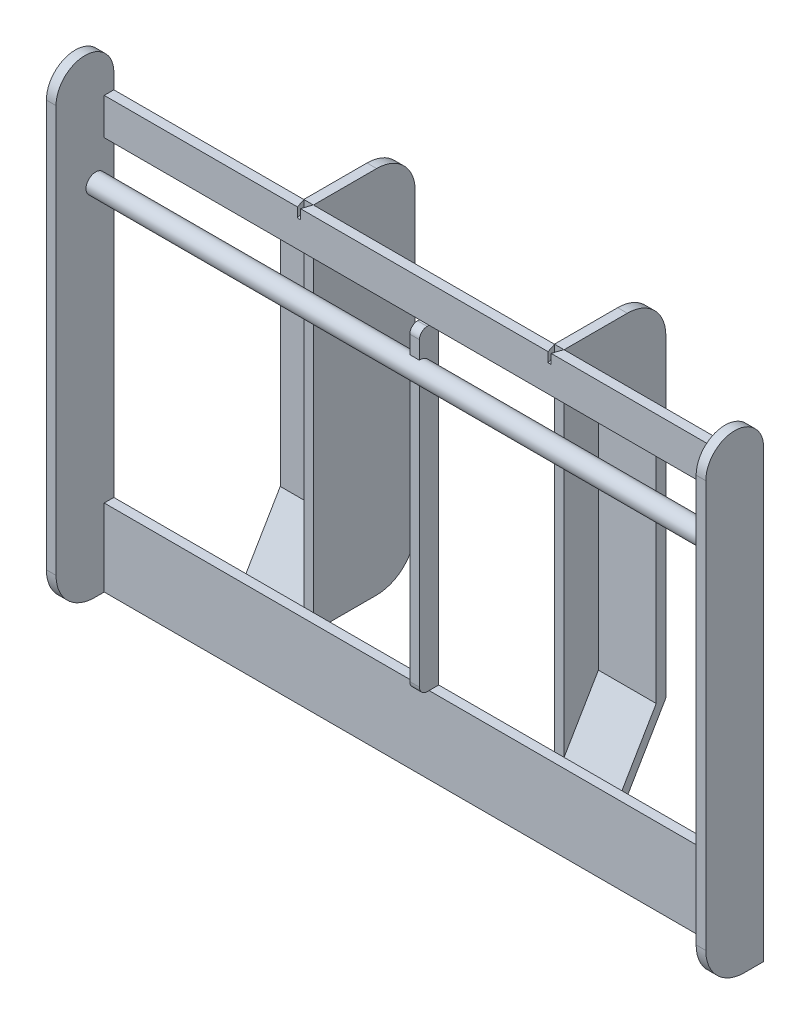
from build123d import *

# Parameters (mm, degrees)
SKETCH1_W                       = 25
SKETCH1_H                       = 264
BOSS_EXTRUDE1_DEPTH             = 958
BOSS_EXTRUDE2_DEPTH             = 150
SKETCH3_W                       = 1660
SKETCH3_H                       = 95
SKETCH3_H_2                     = 200
BOSS_EXTRUDE3_DEPTH             = 25
SKETCH4_W                       = 150
SKETCH4_H                       = 1230
BOSS_EXTRUDE4_DEPTH             = 25
BOSS_EXTRUDE5_REACH             = 1435.453
SKETCH5_R                       = 25
BOSS_EXTRUDE5_DIRECTION_2_REACH = 1435.453
BOSS_EXTRUDE6_REACH             = 1362.836
SKETCH6_W                       = 25
SKETCH6_H                       = 50
FILLET1_RADIUS                  = 75
FILLET1_LENGTH                  = 25
FILLET2_RADIUS                  = 75
FILLET2_LENGTH                  = 25
FILLET3_R                       = 100
FILLET4_R                       = 100
FILLET5_R                       = 100
FILLET6_R                       = 100
FILLET7_R                       = 20
FILLET8_R                       = 20
FILLET9_R                       = 100
FILLET10_R                      = 100
CUT_EXTRUDE5_DEPTH              = 25


with BuildPart() as part:
    # Sketch1 → Boss-Extrude1 (new body)
    with BuildSketch(Plane(origin=(0, 0, 0), x_dir=(1, 0, 0), z_dir=(0, 1, 0))):
        with Locations((325, 0)):
            Rectangle(SKETCH1_W, SKETCH1_H)
    extrude(amount=-BOSS_EXTRUDE1_DEPTH)

    # Sketch2 → Boss-Extrude2 (add)
    with BuildSketch(Plane(origin=(337.5, 0, 0), x_dir=(0, 0, -1), z_dir=(1, 0, 0))):
        Polygon((-43, -139.55), (-43, -763.99), (-132, -915.453947368), (-132, -958), (-18, -763.99), (-18, -139.55), (-132, 0), (-132, -30.603070175), align=None)
    extrude(amount=BOSS_EXTRUDE2_DEPTH)


with BuildPart() as body_2:
    # Mirror2: mirrored copy
    add(part.part.mirror(Plane(origin=(0, 0, 0), x_dir=(0, 0, 1), z_dir=(1, 0, 0))))


with BuildPart() as part_1:
    add(part.part)

    add(body_2.part)  # Boss-Extrude3 merges body 2
    # Sketch3 → Boss-Extrude3 (add)
    with BuildSketch(Plane.XY.offset(132)):
        with Locations((0, -47.5)):
            Rectangle(SKETCH3_W, SKETCH3_H)
        with Locations((0, -1015.453947368)):
            Rectangle(SKETCH3_W, SKETCH3_H_2)
    extrude(amount=BOSS_EXTRUDE3_DEPTH)

    # Sketch4 → Boss-Extrude4 (add)
    with BuildSketch(Plane(origin=(830, 0, 0), x_dir=(0, 0, -1), z_dir=(1, 0, 0))):
        with Locations((-207, -500.453947368)):
            Rectangle(SKETCH4_W, SKETCH4_H)
    boss_extrude4 = extrude(amount=BOSS_EXTRUDE4_DEPTH)

    # Mirror3: Boss-Extrude4 across plane
    add(boss_extrude4.mirror(Plane(origin=(0, 0, 0), x_dir=(0, 0, 1), z_dir=(1, 0, 0))))

    # Sketch5 → Boss-Extrude5 (add, up to next)
    with BuildSketch(Plane(origin=(0, 0, 0), x_dir=(0, 0, -1), z_dir=(1, 0, 0)), mode=Mode.PRIVATE) as boss_extrude5_sk1:
        with Locations((-179.2, -185.96)):
            Circle(SKETCH5_R)
    boss_extrude5_tool1 = extrude(boss_extrude5_sk1.sketch, amount=BOSS_EXTRUDE5_REACH, mode=Mode.PRIVATE) - part_1.part
    add(boss_extrude5_tool1.solids().sort_by_distance((0, -185.96, 179.2))[0])

    # Sketch5 → Boss-Extrude5 direction 2 (add, up to next)
    with BuildSketch(Plane(origin=(0, 0, 0), x_dir=(0, 0, -1), z_dir=(1, 0, 0)), mode=Mode.PRIVATE) as boss_extrude5_direction_2_sk1:
        with Locations((-179.2, -185.96)):
            Circle(SKETCH5_R)
    boss_extrude5_direction_2_tool1 = extrude(boss_extrude5_direction_2_sk1.sketch, amount=-BOSS_EXTRUDE5_DIRECTION_2_REACH, mode=Mode.PRIVATE) - part_1.part
    add(boss_extrude5_direction_2_tool1.solids().sort_by_distance((0, -185.96, 179.2))[0])

    # Boss-Extrude6: up to this face of the body (flat: up to its plane)
    boss_extrude6_end = Plane(part_1.part.faces().sort_by_distance((0, -915.453947368, 144.5))[0])
    # Sketch6 → Boss-Extrude6 (add, up to the picked face)
    with BuildSketch(Plane.XZ.offset(95), mode=Mode.PRIVATE) as boss_extrude6_sk1:
        with Locations((0, 157)):
            Rectangle(SKETCH6_W, SKETCH6_H)
    boss_extrude6_tool1 = split(extrude(boss_extrude6_sk1.sketch, amount=BOSS_EXTRUDE6_REACH, mode=Mode.PRIVATE), bisect_by=boss_extrude6_end, keep=Keep.BOTH, mode=Mode.PRIVATE)
    add(boss_extrude6_tool1.solids().sort_by(Axis((0, -95, 157), (0, -1, 0)))[0])

    # Fillet1: full round fillet: the end face becomes a half cylinder, R = half its width
    fillet1_face = Plane((842.5, 114.546052632, 207), x_dir=(-1, 0, 0), z_dir=(0, 1, 0))  # on the end face: x along it, z out of the body
    fillet1_slab = fillet1_face.offset(-FILLET1_RADIUS / 2) * Box(FILLET1_LENGTH, 2 * FILLET1_RADIUS, FILLET1_RADIUS, mode=Mode.PRIVATE)  # the body's end, R deep
    fillet1_round = Plane((842.5, 39.546052632, 207), x_dir=(0, 1, 0), z_dir=(-1, 0, 0)) * Cylinder(FILLET1_RADIUS, FILLET1_LENGTH, mode=Mode.PRIVATE)  # its axis R under the face
    add(fillet1_slab - fillet1_round, mode=Mode.SUBTRACT)

    # Fillet2: full round fillet: the end face becomes a half cylinder, R = half its width
    fillet2_face = Plane((-842.5, 114.546052632, 207), x_dir=(-1, 0, 0), z_dir=(0, 1, 0))  # on the end face: x along it, z out of the body
    fillet2_slab = fillet2_face.offset(-FILLET2_RADIUS / 2) * Box(FILLET2_LENGTH, 2 * FILLET2_RADIUS, FILLET2_RADIUS, mode=Mode.PRIVATE)  # the body's end, R deep
    fillet2_round = Plane((-842.5, 39.546052632, 207), x_dir=(0, 1, 0), z_dir=(-1, 0, 0)) * Cylinder(FILLET2_RADIUS, FILLET2_LENGTH, mode=Mode.PRIVATE)  # its axis R under the face
    add(fillet2_slab - fillet2_round, mode=Mode.SUBTRACT)

    # Fillet3
    fillet3_edges = [part_1.edges().sort_by_distance(p)[0] for p in [
        (-325, 0, -132),
    ]]
    fillet(fillet3_edges, radius=FILLET3_R)

    # Fillet4
    fillet4_edges = [part_1.edges().sort_by_distance(p)[0] for p in [
        (325, 0, -132),
    ]]
    fillet(fillet4_edges, radius=FILLET4_R)

    # Fillet5
    fillet5_edges = [part_1.edges().sort_by_distance(p)[0] for p in [
        (325, -958, -132),
    ]]
    fillet(fillet5_edges, radius=FILLET5_R)

    # Fillet6
    fillet6_edges = [part_1.edges().sort_by_distance(p)[0] for p in [
        (-325, -958, -132),
    ]]
    fillet(fillet6_edges, radius=FILLET6_R)

    # Fillet7
    fillet7_edges = [part_1.edges().sort_by_distance(p)[0] for p in [
        (0, -95, 182),
    ]]
    fillet(fillet7_edges, radius=FILLET7_R)

    # Fillet8
    fillet8_edges = [part_1.edges().sort_by_distance(p)[0] for p in [
        (0, -915.453947368, 182),
    ]]
    fillet(fillet8_edges, radius=FILLET8_R)

    # Fillet9
    fillet9_edges = [part_1.edges().sort_by_distance(p)[0] for p in [
        (842.5, -1115.453947368, 282),
    ]]
    fillet(fillet9_edges, radius=FILLET9_R)

    # Fillet10
    fillet10_edges = [part_1.edges().sort_by_distance(p)[0] for p in [
        (-842.5, -1115.453947368, 282),
    ]]
    fillet(fillet10_edges, radius=FILLET10_R)

    # Sketch7 → Cut-Extrude5 (cut)
    with BuildSketch(Plane(origin=(0, 0, 0), x_dir=(1, 0, 0), z_dir=(0, 1, 0))):
        Polygon((337, -132), (313, -132), (321, -157), (329, -157), align=None)
    cut_extrude5 = extrude(amount=-CUT_EXTRUDE5_DEPTH, mode=Mode.SUBTRACT)

    # Mirror4: Cut-Extrude5 across plane
    add(cut_extrude5.mirror(Plane(origin=(0, 0, 0), x_dir=(0, 0, 1), z_dir=(1, 0, 0))), mode=Mode.SUBTRACT)


solid = part_1.part
